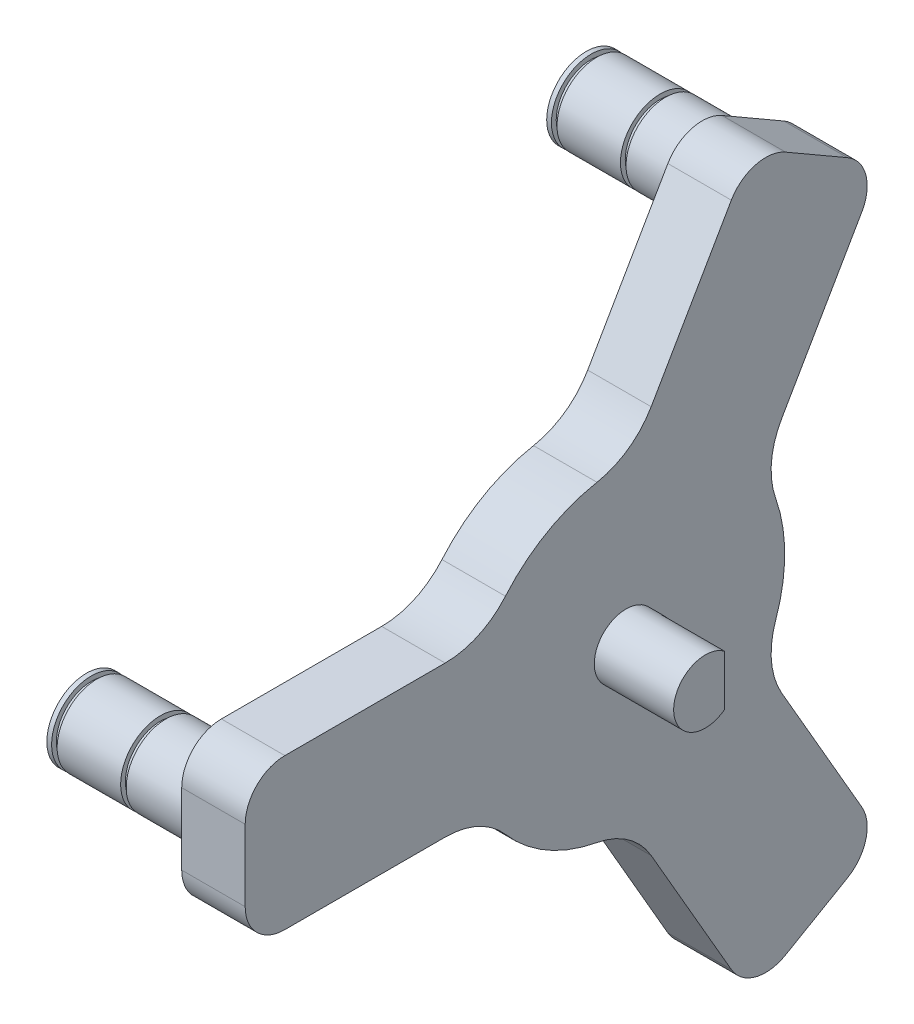
from build123d import *

# Parameters (mm, degrees)
BOSS_EXTRUDE2_DEPTH = 8
FILLET1_R           = 10
FILLET3_R           = 5
FILLET4_R           = 5
SKETCH3_R           = 5
BOSS_EXTRUDE3_DEPTH = 10
SKETCH2_R           = 5
BOSS_EXTRUDE4_DEPTH = 18
SKETCH4_R           = 4
BOSS_EXTRUDE5_DEPTH = 10
CUT_EXTRUDE1_START  = -8
CUT_EXTRUDE1_DEPTH  = 8
SKETCH7_W           = 0.7
SKETCH7_H           = 1.2
CIRPATTERN1_COUNT   = 3


with BuildPart() as part:
    # Sketch1 → Boss-Extrude2 (new body)
    with BuildSketch(Plane.YZ):
        with BuildLine():
            Line((-19.991801075, -0.572616617), (-46.319219382, -15.772758664))
            Line((-46.319219382, -15.772758664), (-36.819219382, -32.227241336))
            Line((-36.819219382, -32.227241336), (-10.491801075, -17.027099289))
            ThreePointArc((-10.491801075, -17.027099289), (0, -20), (10.491801075, -17.027099289))
            Line((10.491801075, -17.027099289), (36.819219382, -32.227241336))
            Line((36.819219382, -32.227241336), (46.319219382, -15.772758664))
            Line((46.319219382, -15.772758664), (19.991801075, -0.572616617))
            ThreePointArc((19.991801075, -0.572616617), (17.320508076, 10), (9.5, 17.599715907))
            Line((9.5, 17.599715907), (9.5, 48))
            Line((9.5, 48), (-9.5, 48))
            Line((-9.5, 48), (-9.5, 17.599715907))
            ThreePointArc((-9.5, 17.599715907), (-17.320508076, 10), (-19.991801075, -0.572616617))
        make_face()
    extrude(amount=BOSS_EXTRUDE2_DEPTH)

    # Fillet1
    fillet1_edges = [part.edges().sort_by_distance(p)[0] for p in [
        (4, 9.5, 17.599715907),
        (4, 19.991801075, -0.572616617),
        (4, 10.491801075, -17.027099289),
        (4, -10.491801075, -17.027099289),
        (4, -19.991801075, -0.572616617),
        (4, -9.5, 17.599715907),
    ]]
    fillet(fillet1_edges, radius=FILLET1_R)

    # Fillet3
    fillet3_edges = [part.edges().sort_by_distance(p)[0] for p in [
        (4, -9.5, 48),
        (4, 9.5, 48),
    ]]
    fillet(fillet3_edges, radius=FILLET3_R)

    # Fillet4
    fillet4_edges = [part.edges().sort_by_distance(p)[0] for p in [
        (4, 46.319219382, -15.772758664),
        (4, 36.819219382, -32.227241336),
        (4, -36.819219382, -32.227241336),
        (4, -46.319219382, -15.772758664),
    ]]
    fillet(fillet4_edges, radius=FILLET4_R)

    # Sketch3 → Boss-Extrude3 (add)
    with BuildSketch(Plane(origin=(0, 0, 0), x_dir=(0, -1, 0), z_dir=(-1, 0, 0))):
        with Locations(Location((0, 0, 0), (0, 0, 270))):
            Circle(SKETCH3_R)
    extrude(amount=BOSS_EXTRUDE3_DEPTH)

    # Sketch2 → Boss-Extrude4 (add)
    with BuildSketch(Plane(origin=(0, 0, 0), x_dir=(0, -1, 0), z_dir=(-1, 0, 0))):
        with Locations(Location((0, 42, 0), (0, 0, 270))):
            Circle(SKETCH2_R)
        with Locations(Location((-36.373066959, -21, 0), (0, 0, 270))):
            Circle(SKETCH2_R)
        with Locations(Location((36.373066959, -21, 0), (0, 0, 270))):
            Circle(SKETCH2_R)
    extrude(amount=BOSS_EXTRUDE4_DEPTH)

    # Sketch4 → Boss-Extrude5 (add)
    with BuildSketch(Plane.YZ.offset(8)):
        with Locations(Location((0, 0, 0), (0, 0, 270))):
            Circle(SKETCH4_R)
    extrude(amount=BOSS_EXTRUDE5_DEPTH)

    # Sketch5 → Cut-Extrude1 (cut)
    with BuildSketch(Plane.YZ.offset(18).offset(CUT_EXTRUDE1_START)):
        with BuildLine():
            Line((-3.2, -2.4), (3.2, -2.4))
            ThreePointArc((3.2, -2.4), (0, -4), (-3.2, -2.4))
        make_face()
    extrude(amount=CUT_EXTRUDE1_DEPTH, mode=Mode.SUBTRACT)

    # Sketch7 → Cut-Revolve1 (revolve, cut)
    with BuildSketch(Plane(origin=(0, 0, 0), x_dir=(-1, 0, 0), z_dir=(0, 1, 0))):
        with Locations((8.35, 47)):
            Rectangle(SKETCH7_W, SKETCH7_H)
        with Locations((17.05, 47)):
            Rectangle(SKETCH7_W, SKETCH7_H)
    cut_revolve1 = revolve(axis=Axis((-21.815535784, 0, 42), (1, 0, 0)), mode=Mode.SUBTRACT)

    # CirPattern1: Cut-Revolve1 ×3 about axis
    cirpattern1_axis = Axis((0, 0, 0), (1, 0, 0))
    for i in range(1, CIRPATTERN1_COUNT):
        add(cut_revolve1.rotate(cirpattern1_axis, i * 360 / CIRPATTERN1_COUNT), mode=Mode.SUBTRACT)


solid = part.part
